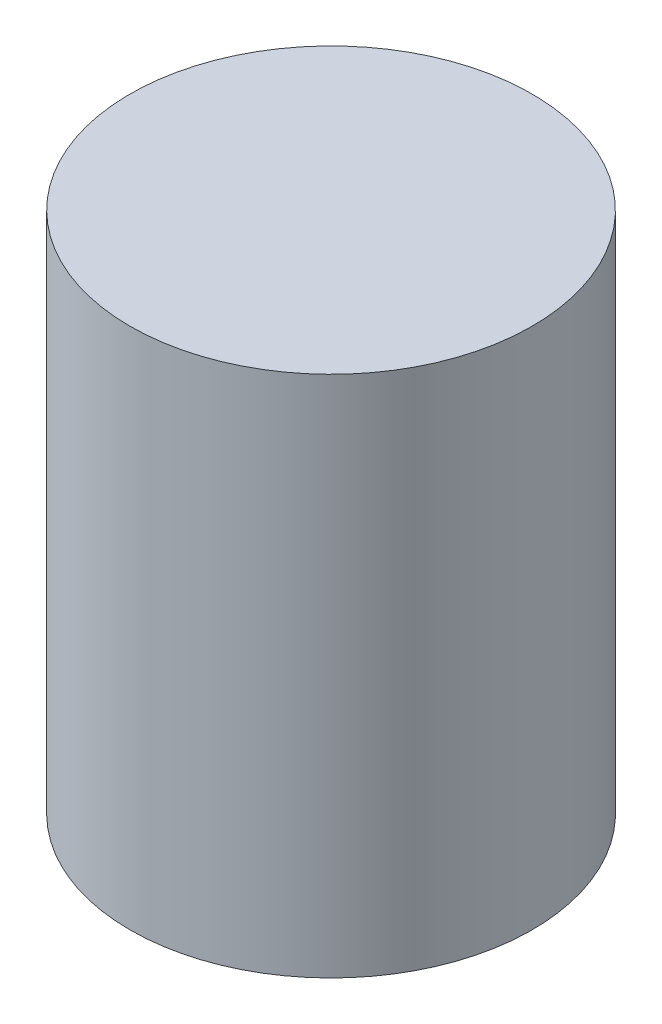
from build123d import *

# Parameters (mm, degrees)
SKETCH_1_R      = 4.5
EXTRUDE_1_DEPTH = 11.7


with BuildPart() as part:
    # 草图1 → 凸台-拉伸1 (new body)
    with BuildSketch(Plane(origin=(0, 0, 0), x_dir=(1, 0, 0), z_dir=(0, 1, 0))):
        with Locations(Location((-38.622021544, 12.531613373, 0), (0, 0, 270))):
            Circle(SKETCH_1_R)
    extrude(amount=EXTRUDE_1_DEPTH)


solid = part.part
